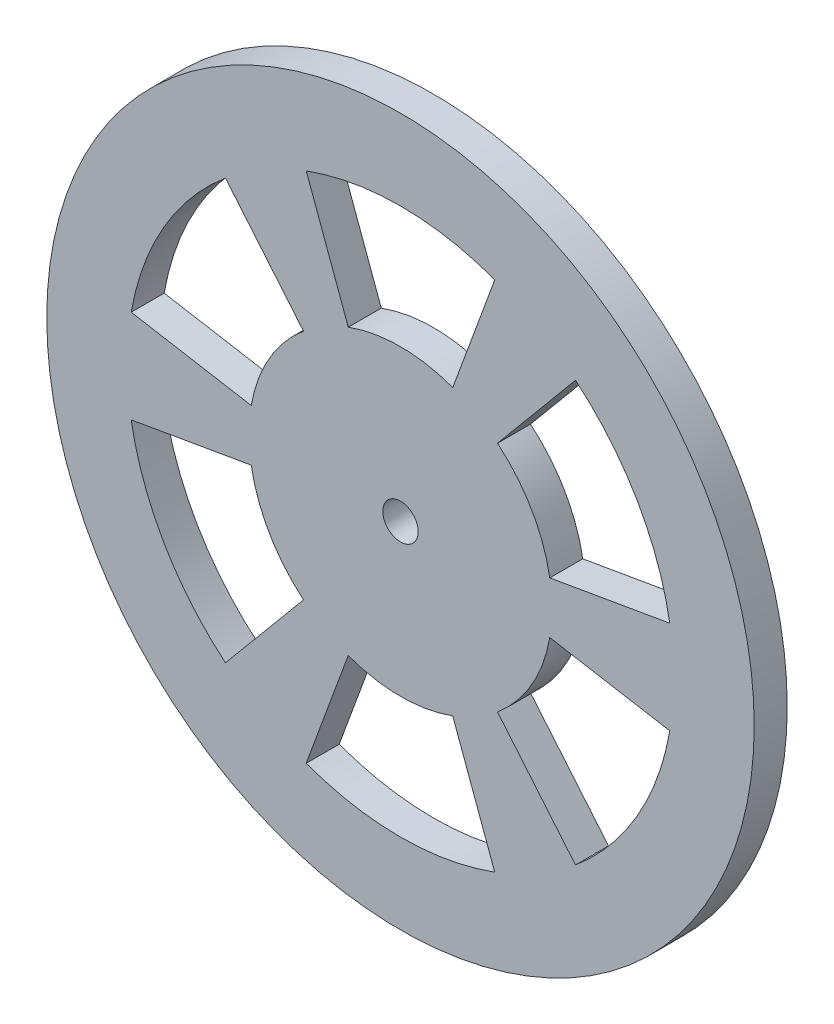
from build123d import *

# Parameters (mm, degrees)
MODEL_R             = 30
MODEL_R_2           = 1.5
BOSS_EXTRUDE1_DEPTH = 2.8


with BuildPart() as part:
    # Model → Boss-Extrude1 (new body)
    with BuildSketch(Plane.XY):
        with Locations((183.021792723, 1.638749849)):
            Circle(MODEL_R)
        with Locations((183.021792723, 1.638749849)):
            Circle(MODEL_R_2, mode=Mode.SUBTRACT)
        with BuildLine():
            Line((160.184310638, 5.594924102), (170.361966665, 3.831832156))
            ThreePointArc((170.361966665, 3.831832156), (171.89553669, 8.064264032), (174.794965696, 11.507899908))
            Line((174.794965696, 11.507899908), (168.18114531, 19.442038508))
            ThreePointArc((168.18114531, 19.442038508), (162.950768709, 13.229948999), (160.184310638, 5.594924102))
        make_face(mode=Mode.SUBTRACT)
        with BuildLine():
            Line((160.183368767, -2.31198349), (170.361444544, -0.551316319))
            ThreePointArc((170.361444544, -0.551316319), (171.894006192, -4.784113433), (174.792614703, -8.228439971))
            Line((174.792614703, -8.228439971), (168.176904275, -16.161002669))
            ThreePointArc((168.176904275, -16.161002669), (162.948007791, -9.947667252), (160.183368767, -2.31198349))
        make_face(mode=Mode.SUBTRACT)
        with BuildLine():
            Line((175.02401618, -20.115272149), (178.588271571, -10.420466378))
            ThreePointArc((178.588271571, -10.420466378), (183.020262224, -11.209627616), (187.452440761, -10.421522278))
            Line((187.452440761, -10.421522278), (191.01438636, -20.117176922))
            ThreePointArc((191.01438636, -20.117176922), (183.019031805, -21.538866402), (175.02401618, -20.115272149))
        make_face(mode=Mode.SUBTRACT)
        with BuildLine():
            Line((197.862440136, -16.16453881), (191.248619749, -8.23040021))
            ThreePointArc((191.248619749, -8.23040021), (194.148048755, -4.786764334), (195.68161878, -0.554332458))
            Line((195.68161878, -0.554332458), (205.859274808, -2.317424405))
            ThreePointArc((205.859274808, -2.317424405), (203.092816736, -9.952449302), (197.862440136, -16.16453881))
        make_face(mode=Mode.SUBTRACT)
        with BuildLine():
            Line((205.860216679, 5.589483188), (195.682140901, 3.828816016))
            ThreePointArc((195.682140901, 3.828816016), (194.149579254, 8.06161313), (191.250970742, 11.505939668))
            Line((191.250970742, 11.505939668), (197.86668117, 19.438502366))
            ThreePointArc((197.86668117, 19.438502366), (203.095577654, 13.225166949), (205.860216679, 5.589483188))
        make_face(mode=Mode.SUBTRACT)
        with BuildLine():
            Line((191.019569265, 23.392771846), (187.455313874, 13.697966076))
            ThreePointArc((187.455313874, 13.697966076), (183.023323222, 14.487127313), (178.591144685, 13.699021976))
            Line((178.591144685, 13.699021976), (175.029199085, 23.39467662))
            ThreePointArc((175.029199085, 23.39467662), (183.024553641, 24.8163661), (191.019569265, 23.392771846))
        make_face(mode=Mode.SUBTRACT)
    extrude(amount=BOSS_EXTRUDE1_DEPTH)


solid = part.part
